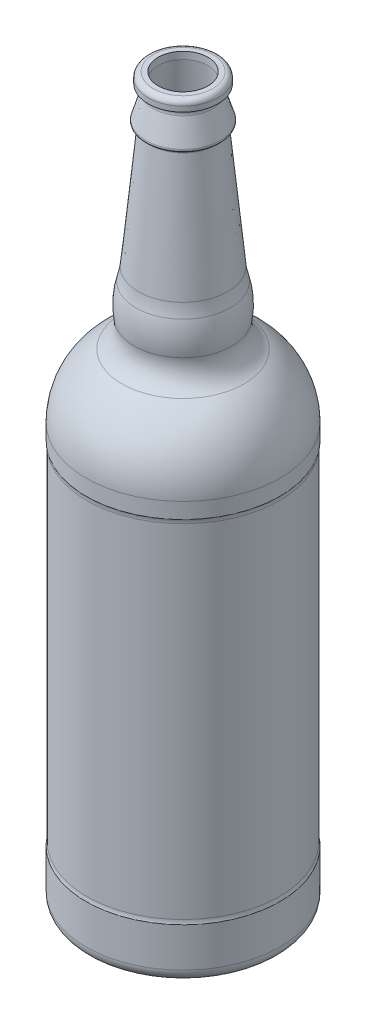
from build123d import *


with BuildPart() as part:
    # Sketch1 → Revolve1 (revolve)
    with BuildSketch(Plane.XY, mode=Mode.PRIVATE) as revolve1_sk:
        with BuildLine():
            Line((37, 5), (37, 20))
            ThreePointArc((37, 20), (36.812895585, 20.770680085), (36.75, 21.5612495))
            Line((36.75, 21.5612495), (36.75, 152.4387505))
            ThreePointArc((36.75, 152.4387505), (36.812895585, 153.229319915), (37, 154))
            Line((37, 154), (37, 160))
            ThreePointArc((37, 160), (33.341477935, 173.969644735), (23.305194805, 184.352745364))
            ThreePointArc((23.305194805, 184.352745364), (19.417053165, 188.714258988), (18.62987013, 194.503973088))
            ThreePointArc((18.62987013, 194.503973088), (18.955236373, 200.678949299), (17.941088983, 206.778760727))
            ThreePointArc((17.941088983, 206.778760727), (17.370530304, 209.221953369), (17.017054653, 211.705858048))
            Line((17.017054653, 211.705858048), (12.504732515, 257.921962326))
            ThreePointArc((12.504732515, 257.921962326), (12.7146369, 258.638170922), (13.362, 259.009567771))
            ThreePointArc((13.362, 259.009567771), (14.066229784, 259.460881283), (14.18121584, 260.289374904))
            Line((14.18121584, 260.289374904), (11.420568319, 269.421250192))
            ThreePointArc((11.420568319, 269.421250192), (11.729151374, 271.192161982), (13.335, 272))
            Line((13.335, 272), (13.335, 274))
            ThreePointArc((13.335, 274), (12.749213562, 275.414213562), (11.335, 276))
            Line((11.335, 276), (9.5, 276))
            Line((9.5, 276), (9.5, 273.260680415))
            Line((9.5, 273.260680415), (15.524153426, 211.560098223))
            ThreePointArc((15.524153426, 211.560098223), (15.896233059, 208.945461719), (16.496821141, 206.373679991))
            ThreePointArc((16.496821141, 206.373679991), (17.457592354, 200.594911269), (17.149350649, 194.744933807))
            ThreePointArc((17.149350649, 194.744933807), (18.05461114, 188.086762591), (22.525974026, 183.071021924))
            ThreePointArc((22.525974026, 183.071021924), (32.034031727, 173.234400275), (35.5, 160))
            Line((35.5, 160), (35.5, 154.224107608))
            ThreePointArc((35.5, 154.224107608), (35.312803405, 153.340138319), (35.25, 152.4387505))
            Line((35.25, 152.4387505), (35.25, 21.5612495))
            ThreePointArc((35.25, 21.5612495), (35.312803405, 20.659861681), (35.5, 19.775892392))
            Line((35.5, 19.775892392), (35.5, 5))
            ThreePointArc((35.5, 5), (34.2184271, 2.292864761), (31.312239314, 1.568238756))
            ThreePointArc((31.312239314, 1.568238756), (15.73299317, 3.896407535), (0, 4.675))
            Line((0, 4.675), (0, 3.175))
            ThreePointArc((0, 3.175), (15.584892239, 2.403736736), (31.017484734, 0.097483937))
            ThreePointArc((31.017484734, 0.097483937), (35.169181572, 1.132663945), (37, 5))
        make_face()
    revolve(revolve1_sk.sketch.rotate(Axis((0, 0, 0), (0, 1, 0)), 90), axis=Axis((0, 0, 0), (0, 1, 0)))


solid = part.part
